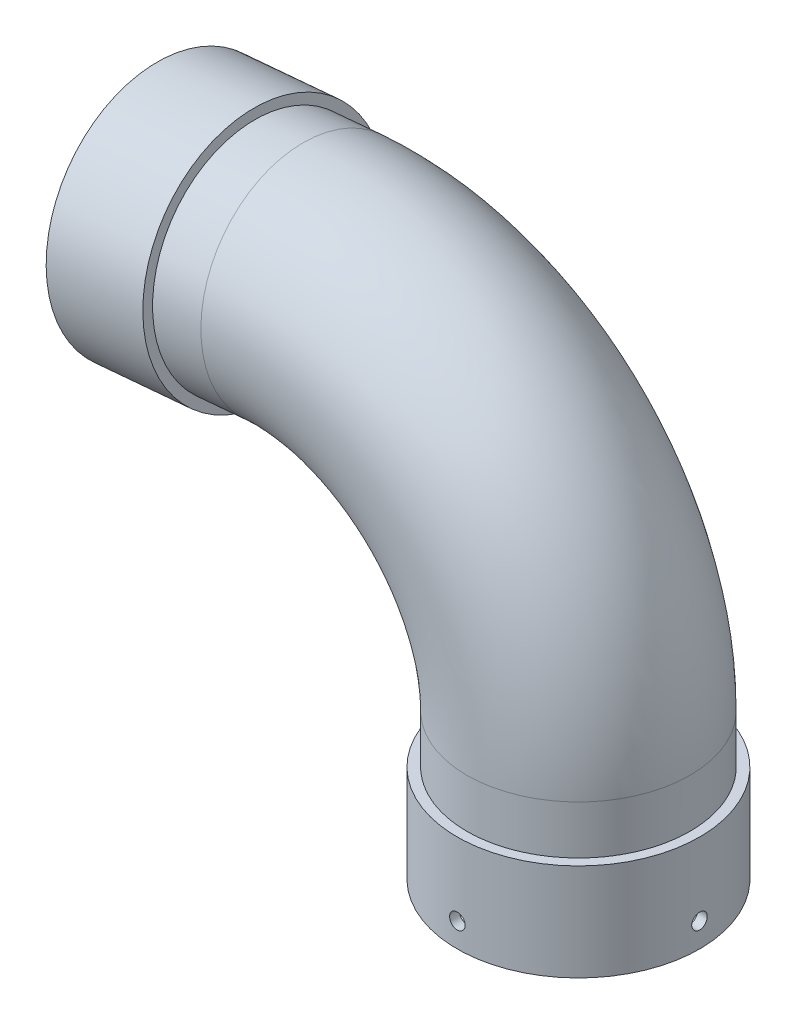
from build123d import *

# Parameters (mm, degrees)
SKETCH_1_R               = 23
SKETCH_1_R_2             = 21
EXTRUDE_1_DEPTH          = 10
EXTRUDE_1_DEPTH_BACK     = 10
SKETCH_3_R               = 25
SKETCH_3_R_2             = 23
EXTRUDE_2_DEPTH          = 10
EXTRUDE_2_DEPTH_BACK     = 10
SKETCH_4_R               = 25
SKETCH_4_R_2             = 23
CUT_EXTRUDE_1_DEPTH      = 131.4990784
CUT_EXTRUDE_1_DEPTH_BACK = 131.4990784
SKETCH_5_R               = 1.6
CUT_EXTRUDE_2_DEPTH      = 131.499078423
CUT_EXTRUDE_2_DEPTH_BACK = 131.499078423
SKETCH_7_R               = 1.6


with BuildPart() as part:
    # 扫描1: sweep along a path in 草图2
    with BuildLine(Plane.XY) as sweep_1_path:
        Line((0, 0), (0, 20))
        ThreePointArc((0, 20), (-16.332451735, 57.118320104), (-54.732992387, 70.153547171))
        Line((-54.732992387, 70.153547171), (-74.656886349, 68.410432316))
    # 草图1 → 扫描1 (sweep)
    with BuildSketch(Plane(origin=(0, 0, 0), x_dir=(1, 0, 0), z_dir=(0, 1, 0))):
        Circle(SKETCH_1_R)
        Circle(SKETCH_1_R_2, mode=Mode.SUBTRACT)
    sweep(path=sweep_1_path.line)

    # 草图4 → 凸台-拉伸2 (add, two sides: drawn at the far end of the back side and taken through both)
    with BuildSketch(Plane(origin=(-68.150109968, -5.96236204, 0), x_dir=(0, 0, 1), z_dir=(-0.9961946980917464, -0.08715574274764801, 0)).offset(-EXTRUDE_2_DEPTH_BACK)):
        with Locations((0, 74.656886349)):
            Circle(SKETCH_4_R)
        with Locations((0, 74.656886349)):
            Circle(SKETCH_4_R_2, mode=Mode.SUBTRACT)
    extrude(amount=EXTRUDE_2_DEPTH + EXTRUDE_2_DEPTH_BACK)


with BuildPart() as body_2:
    # 草图3 → 凸台-拉伸1 (new, two sides: drawn at the far end of the back side and taken through both)
    with BuildSketch(Plane.XZ.offset(-EXTRUDE_1_DEPTH_BACK)):
        Circle(SKETCH_3_R)
        Circle(SKETCH_3_R_2, mode=Mode.SUBTRACT)
    extrude(amount=EXTRUDE_1_DEPTH + EXTRUDE_1_DEPTH_BACK)

    # 草图5 → 切除-拉伸1 (cut, two sides: drawn at the far end of the back side and taken through both)
    with BuildSketch(Plane.XY.offset(-CUT_EXTRUDE_1_DEPTH_BACK)):
        with Locations((0, -5)):
            Circle(SKETCH_5_R)
    extrude(amount=CUT_EXTRUDE_1_DEPTH + CUT_EXTRUDE_1_DEPTH_BACK, mode=Mode.SUBTRACT)

    # 草图7 → 切除-拉伸2 (cut, two sides: drawn at the far end of the back side and taken through both)
    with BuildSketch(Plane(origin=(0, 0, 0), x_dir=(0, 0, -1), z_dir=(1, 0, 0)).offset(-CUT_EXTRUDE_2_DEPTH_BACK)):
        with Locations((0, -5)):
            Circle(SKETCH_7_R)
    extrude(amount=CUT_EXTRUDE_2_DEPTH + CUT_EXTRUDE_2_DEPTH_BACK, mode=Mode.SUBTRACT)


solid = Compound([part.part, body_2.part])
